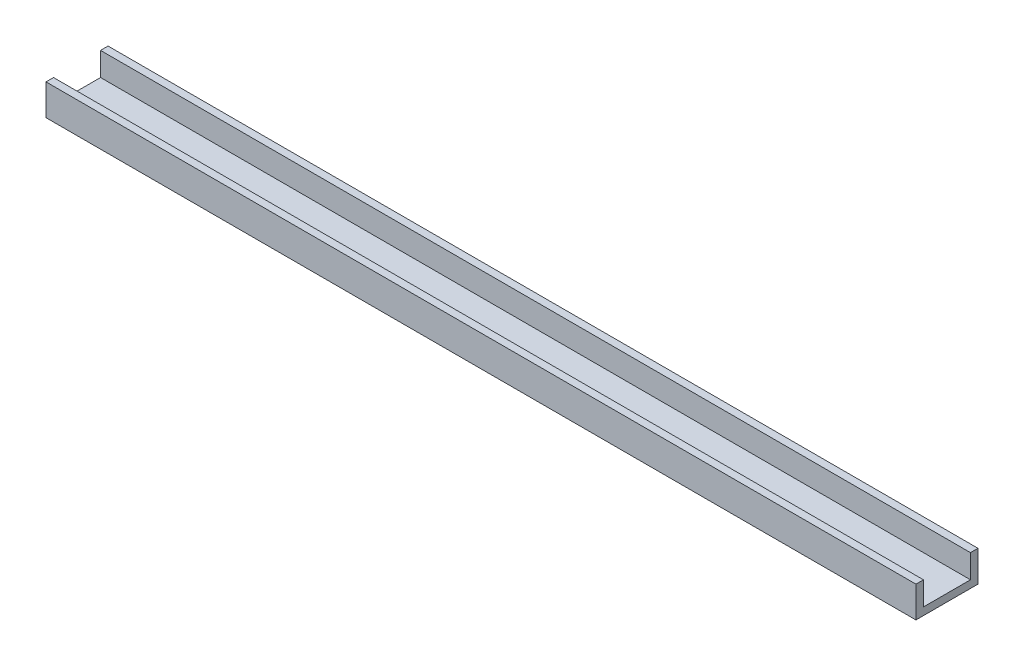
from build123d import *

# Parameters (mm, degrees)
AUFSATZ_LINEAR_AUSTRAGEN1_DEPTH = 1850


with BuildPart() as part:
    # Skizze1 → Aufsatz-Linear austragen1 (new body)
    with BuildSketch(Plane(origin=(0, 0, 0), x_dir=(0, 0, -1), z_dir=(1, 0, 0))):
        Polygon((0, 50), (0, 0), (100, 0), (100, 50), (116, 50), (116, -16), (-16, -16), (-16, 50), align=None)
    extrude(amount=AUFSATZ_LINEAR_AUSTRAGEN1_DEPTH)


solid = part.part
